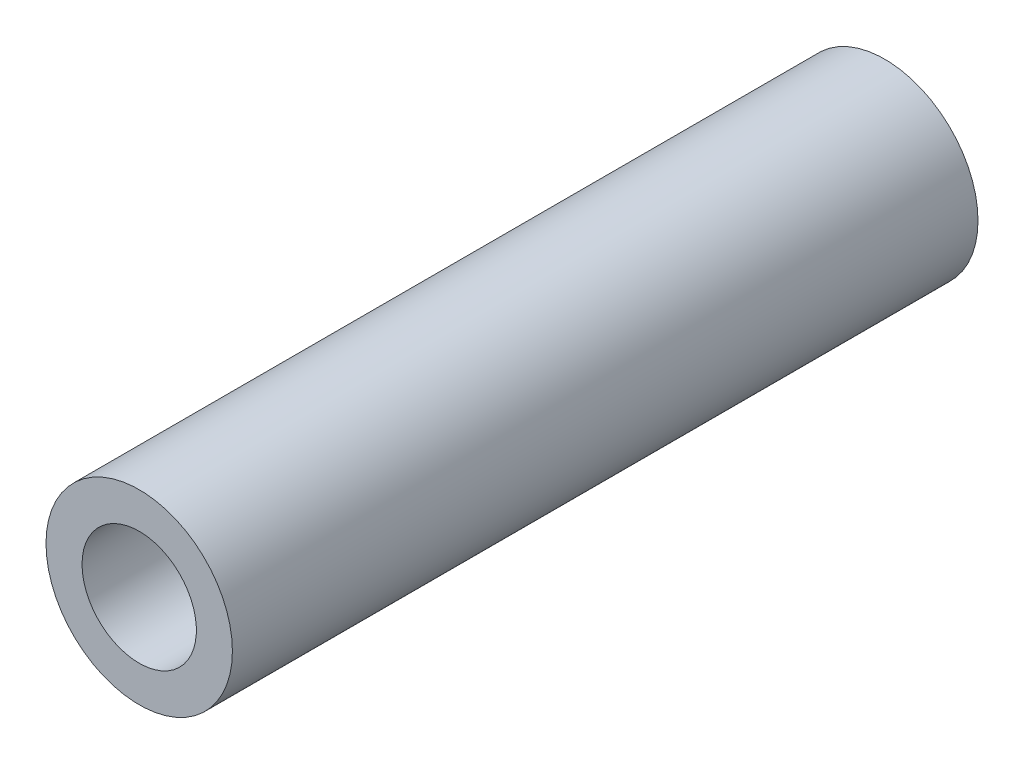
from build123d import *

# Parameters (mm, degrees)
EXTRUDE1_DEPTH      = 9.525
EXTRUDE1_DEPTH_BACK = 9.525
SKETCH1_R           = 2.38125
SKETCH1_R_2         = 1.4605


with BuildPart() as part:
    # Sketch1 → Extrude1 (new, two sides: drawn at the far end of the back side and taken through both)
    with BuildSketch(Plane.XY.offset(-EXTRUDE1_DEPTH_BACK)):
        with Locations(Location((0, 0, 0), (0, 0, 180))):
            Circle(SKETCH1_R)
        with Locations(Location((0, 0, 0), (0, 0, 180))):
            Circle(SKETCH1_R_2, mode=Mode.SUBTRACT)
    extrude(amount=EXTRUDE1_DEPTH + EXTRUDE1_DEPTH_BACK)


solid = part.part
